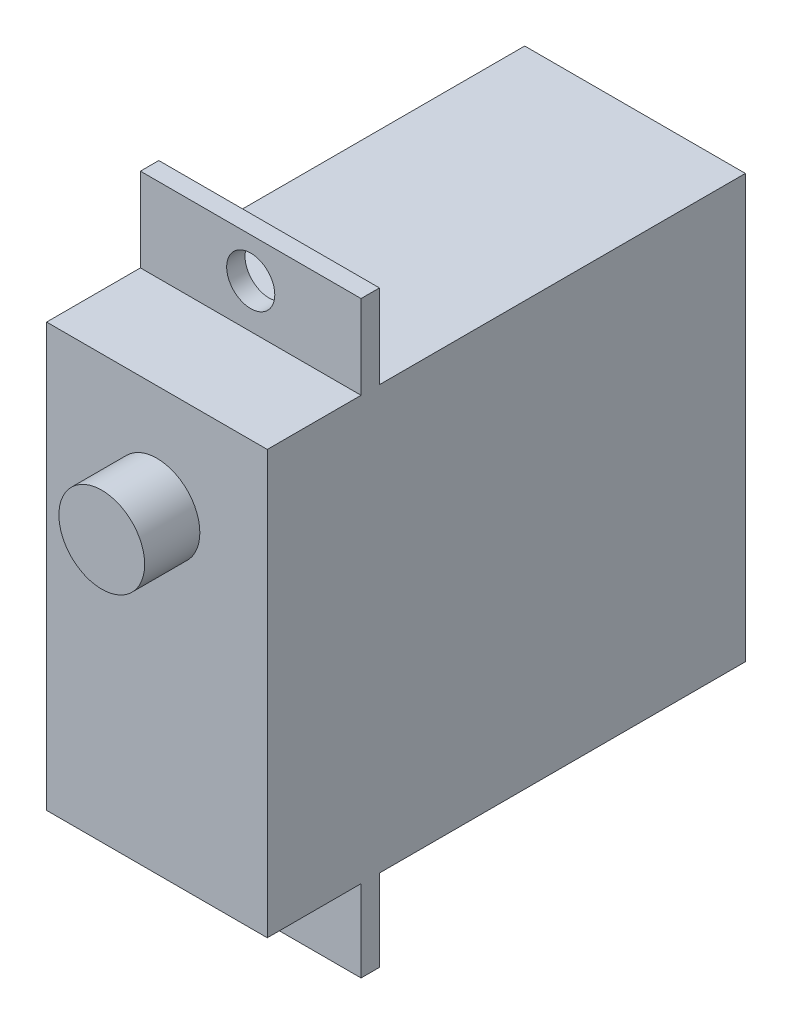
from build123d import *

# Parameters (mm, degrees)
SKETCH_1_W          = 12
SKETCH_1_H          = 23
EXTRUDE_1_DEPTH     = 26
SKETCH_2_R          = 2.332740267
EXTRUDE_2_DEPTH     = 3
SKETCH_3_W          = 1
SKETCH_3_H          = 32
EXTRUDE_3_DEPTH     = 12
SKETCH_4_R          = 1.308316264
SKETCH_4_R_2        = 1.22970194
CUT_EXTRUDE_1_DEPTH = 10


with BuildPart() as part:
    # 草图1 → 凸台-拉伸1 (new body)
    with BuildSketch(Plane.XY):
        with Locations((4.532123023, 1.863128492)):
            Rectangle(SKETCH_1_W, SKETCH_1_H)
    extrude(amount=EXTRUDE_1_DEPTH)

    # 草图2 → 凸台-拉伸2 (add)
    with BuildSketch(Plane.XY.offset(26)):
        with Locations((4.532123023, 7.613128492)):
            Circle(SKETCH_2_R)
    extrude(amount=EXTRUDE_2_DEPTH)

    # 草图3 → 凸台-拉伸3 (add)
    with BuildSketch(Plane(origin=(10.532123023, 0, 0), x_dir=(0, 0, -1), z_dir=(1, 0, 0))):
        with Locations((-20.4, 1.919988583)):
            Rectangle(SKETCH_3_W, SKETCH_3_H)
    extrude(amount=-EXTRUDE_3_DEPTH)

    # 草图4 → 切除-拉伸1 (cut)
    with BuildSketch(Plane.XY.offset(20.9)):
        with Locations((4.532123023, 15.753010852)):
            Circle(SKETCH_4_R)
        with Locations((4.532123023, -11.827886658)):
            Circle(SKETCH_4_R_2)
    extrude(amount=-CUT_EXTRUDE_1_DEPTH, mode=Mode.SUBTRACT)


solid = part.part
